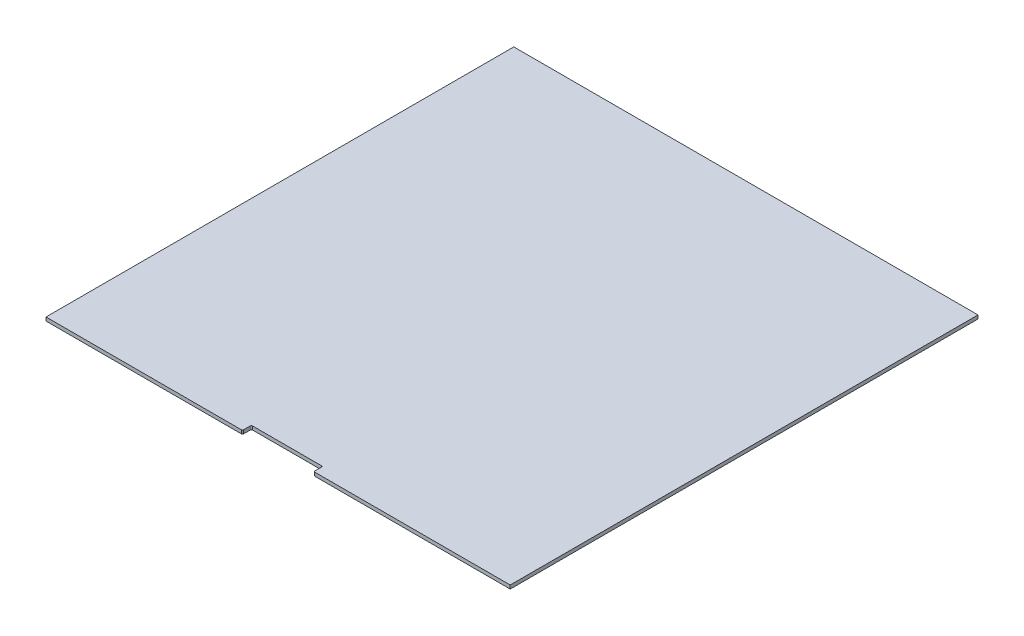
from build123d import *

# Parameters (mm, degrees)
SKETCH_1_W          = 391
SKETCH_1_H          = 394
EXTRUDE_1_DEPTH     = 3
SKETCH_2_W          = 60
SKETCH_2_H          = 7.5
CUT_EXTRUDE_1_DEPTH = 278.557651669
FILLET_1_R          = 1


with BuildPart() as part:
    # 草圖1 → 填料-伸長1 (new body)
    with BuildSketch(Plane(origin=(0, 0, 0), x_dir=(1, 0, 0), z_dir=(0, 1, 0))):
        Rectangle(SKETCH_1_W, SKETCH_1_H)
    extrude(amount=EXTRUDE_1_DEPTH)

    # 草圖2 → 除料-伸長1 (cut, through all)
    with BuildSketch(Plane(origin=(0, 3, 0), x_dir=(1, 0, 0), z_dir=(0, 1, 0))):
        with Locations((0, -193.25)):
            Rectangle(SKETCH_2_W, SKETCH_2_H)
    extrude(amount=-CUT_EXTRUDE_1_DEPTH, mode=Mode.SUBTRACT)

    # 圓角1
    fillet_1_edges = [part.edges().sort_by_distance(p)[0] for p in [
        (-30, 1.5, 197),
        (-30, 1.5, 189.5),
        (30, 1.5, 189.5),
        (30, 1.5, 197),
    ]]
    fillet(fillet_1_edges, radius=FILLET_1_R)


solid = part.part
